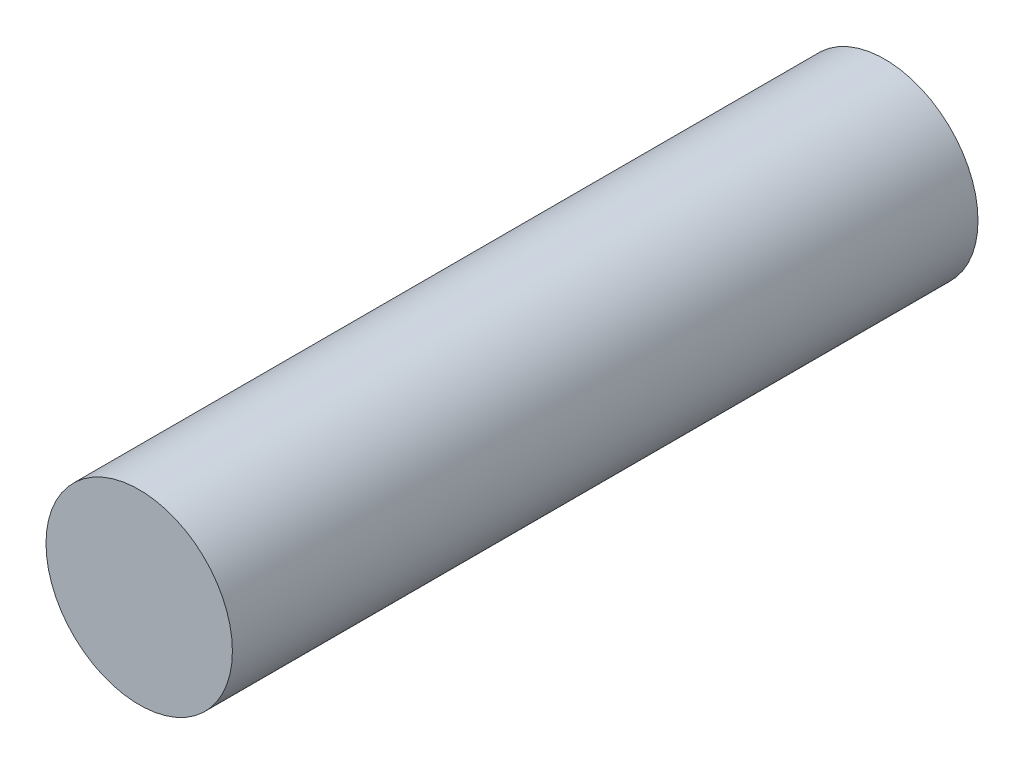
from build123d import *

# Parameters (mm, degrees)
SKETCH_1_R      = 5
EXTRUDE_1_DEPTH = 40


with BuildPart() as part:
    # 草图1 → 凸台-拉伸1 (new body)
    with BuildSketch(Plane.XY):
        Circle(SKETCH_1_R)
    extrude(amount=EXTRUDE_1_DEPTH)


solid = part.part
